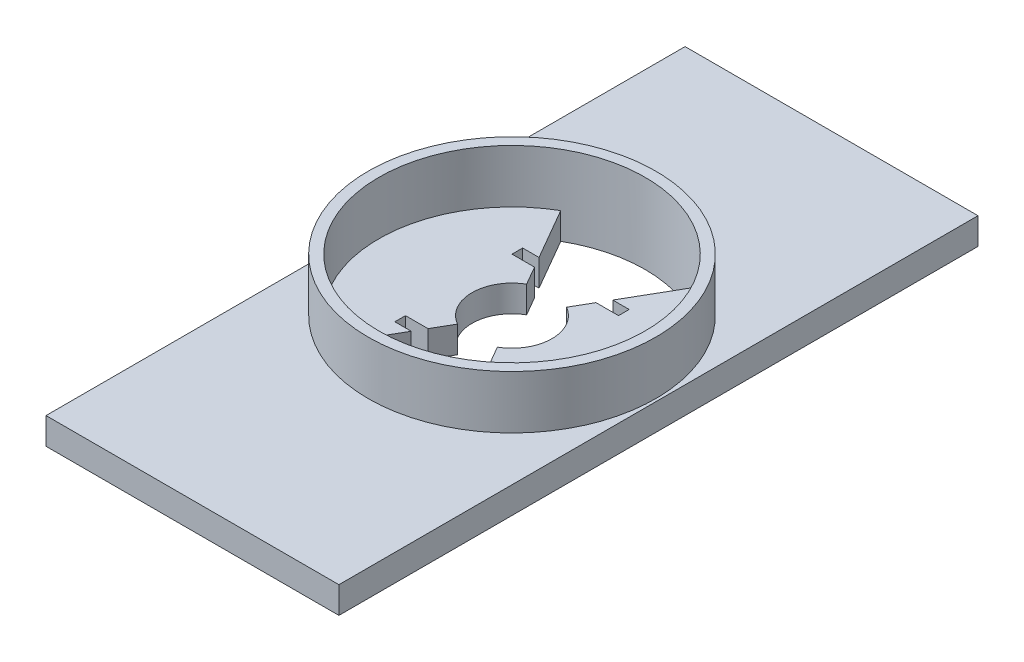
from build123d import *

# Parameters (mm, degrees)
SKETCH1_W           = 102
SKETCH1_H           = 120
SKETCH1_W_2         = 20
SKETCH1_H_2         = 2
BOSS_EXTRUDE1_DEPTH = 5
CUT_EXTRUDE12_DEPTH = 10
BOSS_EXTRUDE3_START = 10
SKETCH5_R           = 27
SKETCH5_R_2         = 25
BOSS_EXTRUDE3_DEPTH = 10
SKETCH6_W           = 23.5
SKETCH6_H           = 120
CUT_EXTRUDE15_DEPTH = 10


with BuildPart() as part:
    # Sketch1 → Boss-Extrude1 (new body)
    with BuildSketch(Plane(origin=(0, 0, 0), x_dir=(1, 0, 0), z_dir=(0, 1, 0))):
        Rectangle(SKETCH1_W, SKETCH1_H)
        with Locations((0, -11)):
            Rectangle(SKETCH1_W_2, SKETCH1_H_2, mode=Mode.SUBTRACT)
        with Locations((0, 11)):
            Rectangle(SKETCH1_W_2, SKETCH1_H_2, mode=Mode.SUBTRACT)
    extrude(amount=BOSS_EXTRUDE1_DEPTH)

    # Sketch2 → Cut-Extrude12 (cut)
    with BuildSketch(Plane(origin=(0, 5, 0), x_dir=(1, 0, 0), z_dir=(0, 1, 0))):
        with BuildLine():
            Line((3.75, 6.495190528), (12.5, 21.650635095))
            ThreePointArc((12.5, 21.650635095), (0, 25), (-12.5, 21.650635095))
            Line((-12.5, 21.650635095), (-3.75, 6.495190528))
            ThreePointArc((-3.75, 6.495190528), (-7.5, 0), (-3.75, -6.495190528))
            Line((-3.75, -6.495190528), (-12.5, -21.650635095))
            ThreePointArc((-12.5, -21.650635095), (0, -25), (12.5, -21.650635095))
            Line((12.5, -21.650635095), (3.75, -6.495190528))
            ThreePointArc((3.75, -6.495190528), (7.5, 0), (3.75, 6.495190528))
        make_face()
    extrude(amount=-CUT_EXTRUDE12_DEPTH, mode=Mode.SUBTRACT)

    # Sketch5 → Boss-Extrude3 (add)
    with BuildSketch(Plane(origin=(0, 5, 0), x_dir=(1, 0, 0), z_dir=(0, 1, 0)).offset(BOSS_EXTRUDE3_START)):
        with Locations(Location((0, 0, 0), (0, 0, 270))):
            Circle(SKETCH5_R)
        with Locations(Location((0, 0, 0), (0, 0, 270))):
            Circle(SKETCH5_R_2, mode=Mode.SUBTRACT)
    extrude(amount=-BOSS_EXTRUDE3_DEPTH)

    # Sketch6 → Cut-Extrude15 (cut)
    with BuildSketch(Plane(origin=(0, 5, 0), x_dir=(1, 0, 0), z_dir=(0, 1, 0))):
        with Locations((-39.25, 0)):
            Rectangle(SKETCH6_W, SKETCH6_H)
        with Locations((39.25, 0)):
            Rectangle(SKETCH6_W, SKETCH6_H)
    extrude(amount=-CUT_EXTRUDE15_DEPTH, mode=Mode.SUBTRACT)


solid = part.part
